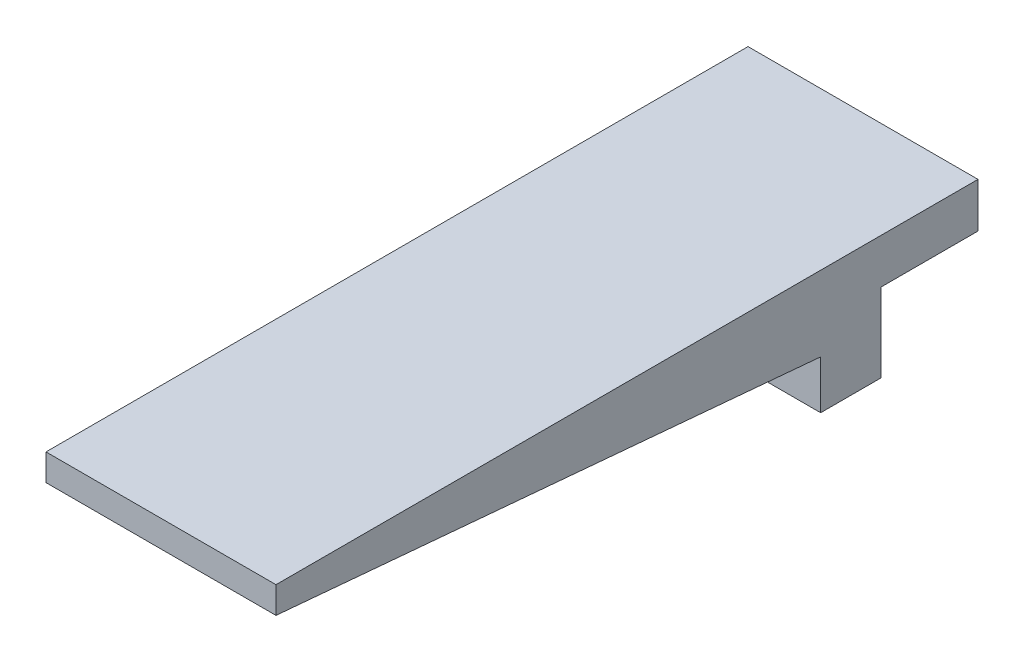
from build123d import *

# Parameters (mm, degrees)
SKETCH1_W           = 19
SKETCH1_H           = 6.5
BOSS_EXTRUDE1_DEPTH = 50
SKETCH2_W           = 19
SKETCH2_H           = 58
BOSS_EXTRUDE2_DEPTH = 3.7
CUT_EXTRUDE1_DEPTH  = 54.937950462


with BuildPart() as part:
    # Sketch1 → Boss-Extrude1 (new body)
    with BuildSketch(Plane.XY):
        Rectangle(SKETCH1_W, SKETCH1_H)
    extrude(amount=BOSS_EXTRUDE1_DEPTH)

    # Sketch2 → Boss-Extrude2 (add)
    with BuildSketch(Plane(origin=(0, 3.25, 0), x_dir=(1, 0, 0), z_dir=(0, 1, 0))):
        with Locations((0, -21)):
            Rectangle(SKETCH2_W, SKETCH2_H)
    extrude(amount=BOSS_EXTRUDE2_DEPTH)

    # Sketch3 → Cut-Extrude1 (cut, through all)
    with BuildSketch(Plane.ZY.offset(9.5)):
        Polygon((50, 4.75), (50, -3.25), (5, -3.25), (5, 0.75), align=None)
    extrude(amount=-CUT_EXTRUDE1_DEPTH, mode=Mode.SUBTRACT)


solid = part.part
